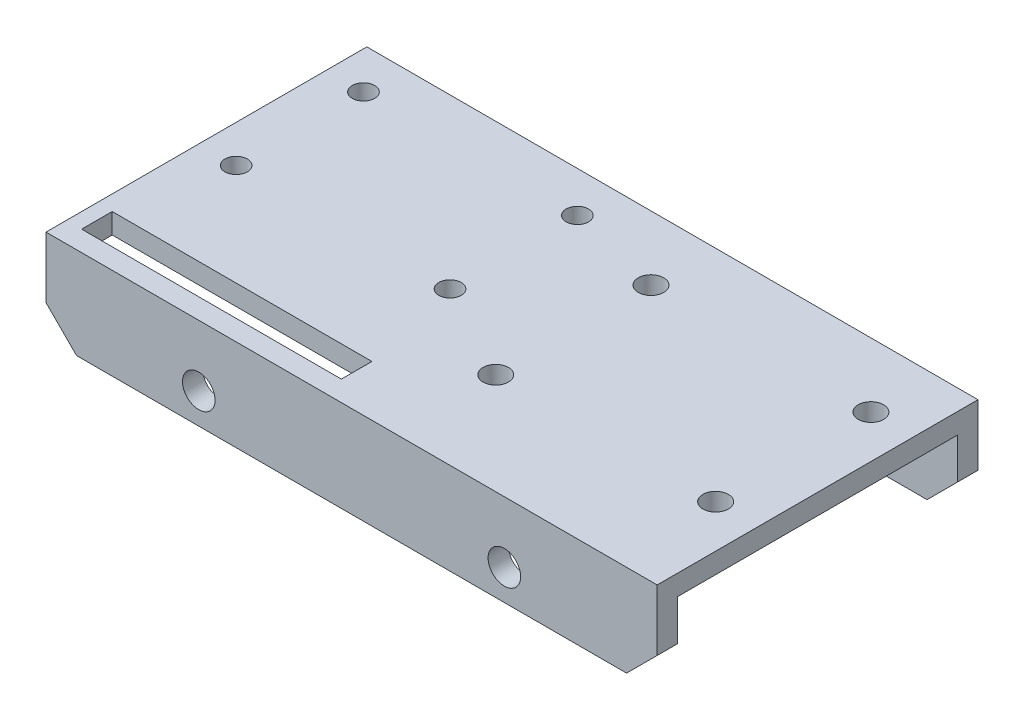
from build123d import *

# Parameters (mm, degrees)
SKETCH1_W               = 60
SKETCH1_H               = 31.5
BOSS_EXTRUDE1_DEPTH     = 2
SKETCH2_W               = 60
SKETCH2_H               = 2
BOSS_EXTRUDE2_DEPTH     = 7
CUT_EXTRUDE1_DEPTH      = 45.0596187
CUT_EXTRUDE1_DEPTH_BACK = 45.0596187
SKETCH3_R               = 1.6
CHAMFER1_SIZE           = 3
CHAMFER3_SIZE           = 3
SKETCH4_R               = 1.25
SKETCH4_R_2             = 1.1
CUT_EXTRUDE2_DEPTH      = 10
SKETCH5_W               = 25.5
SKETCH5_H               = 3
CUT_EXTRUDE3_DEPTH      = 10


with BuildPart() as part:
    # Sketch1 → Boss-Extrude1 (new body)
    with BuildSketch(Plane(origin=(0, 0, 0), x_dir=(1, 0, 0), z_dir=(0, 1, 0))):
        Rectangle(SKETCH1_W, SKETCH1_H)
    extrude(amount=BOSS_EXTRUDE1_DEPTH)

    # Sketch2 → Boss-Extrude2 (add)
    with BuildSketch(Plane.XZ):
        with Locations((0, -14.75)):
            Rectangle(SKETCH2_W, SKETCH2_H)
        with Locations((0, 14.75)):
            Rectangle(SKETCH2_W, SKETCH2_H)
    extrude(amount=BOSS_EXTRUDE2_DEPTH)

    # Sketch3 → Cut-Extrude1 (cut, two sides: drawn at the far end of the back side and taken through both)
    with BuildSketch(Plane(origin=(0, 0, -15.75), x_dir=(-1, 0, 0), z_dir=(0, 0, -1)).offset(-CUT_EXTRUDE1_DEPTH_BACK)):
        with Locations((15, -4)):
            Circle(SKETCH3_R)
        with Locations(Location((-15, -4, 0), (0, 0, 180))):
            Circle(SKETCH3_R)
    extrude(amount=CUT_EXTRUDE1_DEPTH + CUT_EXTRUDE1_DEPTH_BACK, mode=Mode.SUBTRACT)

    # Chamfer1
    chamfer1_edges = [part.edges().sort_by_distance(p)[0] for p in [
        (30, -7, -14.75),
        (-30, -7, -14.75),
    ]]
    chamfer(chamfer1_edges, length=CHAMFER1_SIZE)

    # Chamfer3
    chamfer3_edges = [part.edges().sort_by_distance(p)[0] for p in [
        (30, -7, 14.75),
        (-30, -7, 14.75),
    ]]
    chamfer(chamfer3_edges, length=CHAMFER3_SIZE)

    # Sketch4 → Cut-Extrude2 (cut)
    with BuildSketch(Plane(origin=(0, 2, 0), x_dir=(1, 0, 0), z_dir=(0, 1, 0))):
        with Locations(Location((25.795, -5.801, 0), (0, 0, 270))):
            Circle(SKETCH4_R)
        with Locations(Location((4.205, -5.801, 0), (0, 0, 270))):
            Circle(SKETCH4_R)
        with Locations(Location((25.795, 9.439, 0), (0, 0, 270))):
            Circle(SKETCH4_R)
        with Locations(Location((4.205, 9.439, 0), (0, 0, 270))):
            Circle(SKETCH4_R)
        with Locations(Location((-26.335, -0.75, 0), (0, 0, 270))):
            Circle(SKETCH4_R_2)
        with Locations(Location((-26.335, 11.75, 0), (0, 0, 270))):
            Circle(SKETCH4_R_2)
        with Locations(Location((-5.335, -0.75, 0), (0, 0, 270))):
            Circle(SKETCH4_R_2)
        with Locations(Location((-5.335, 11.75, 0), (0, 0, 270))):
            Circle(SKETCH4_R_2)
    extrude(amount=-CUT_EXTRUDE2_DEPTH, mode=Mode.SUBTRACT)

    # Sketch5 → Cut-Extrude3 (cut)
    with BuildSketch(Plane.XZ):
        with Locations((-15.75, 12.25)):
            Rectangle(SKETCH5_W, SKETCH5_H)
    extrude(amount=-CUT_EXTRUDE3_DEPTH, mode=Mode.SUBTRACT)


solid = part.part
